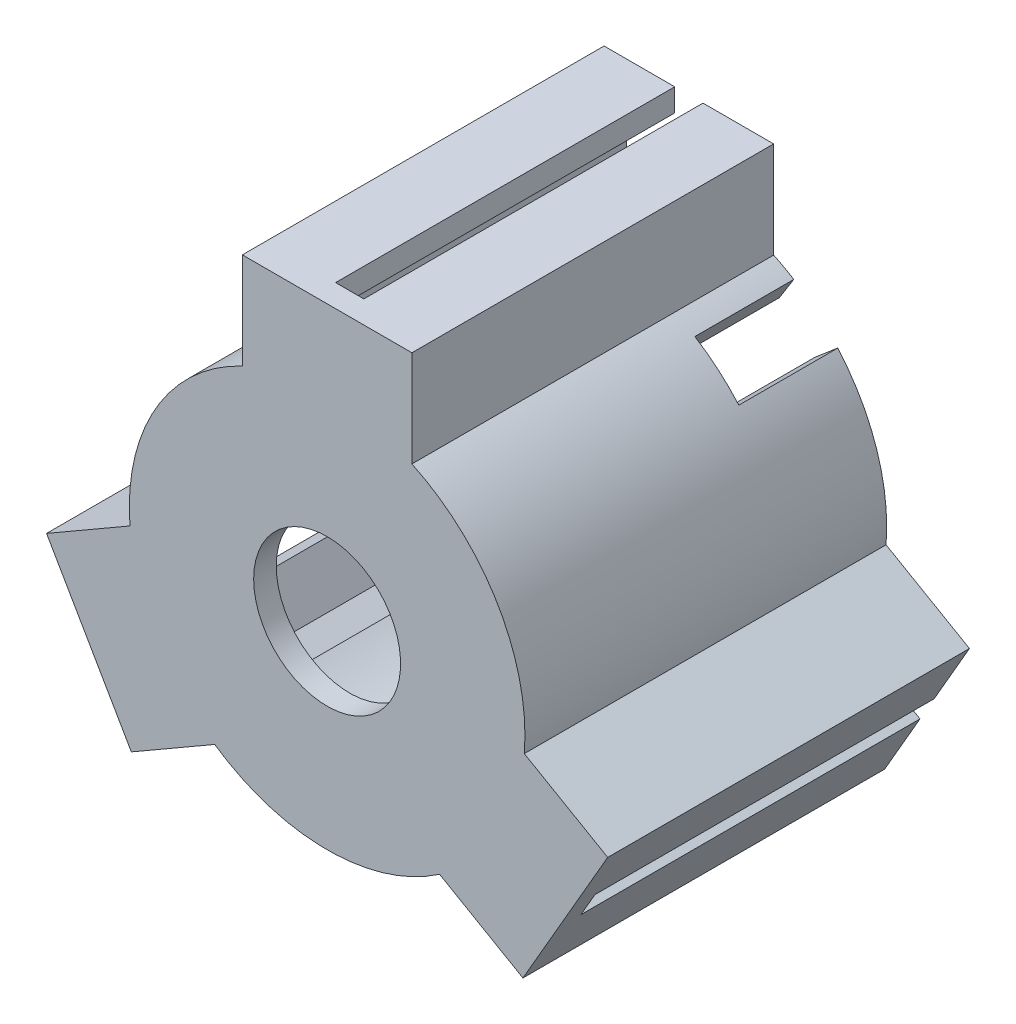
from build123d import *

# Parameters (mm, degrees)
SALIENTE_EXTRUIR1_DEPTH = 0.8
SALIENTE_EXTRUIR2_START = 12
SALIENTE_EXTRUIR2_DEPTH = 12
CROQUIS3_R              = 2.6
CORTAR_EXTRUIR1_DEPTH   = 0.8
CORTAR_EXTRUIR2_DEPTH   = 3.5


with BuildPart() as part:
    # Croquis1 → Saliente-Extruir1 (new body)
    with BuildSketch(Plane.XY):
        with BuildLine():
            Line((-64.04061015, 19.417127137), (-64.04061015, 22.824622624))
            Line((-64.04061015, 22.824622624), (-58.04061015, 22.824622624))
            Line((-58.04061015, 22.824622624), (-58.04061015, 19.417127137))
            ThreePointArc((-58.04061015, 19.417127137), (-54.978432324, 16.592571816), (-54.063384575, 12.528370368))
            Line((-54.063384575, 12.528370368), (-51.11240692, 10.824622624))
            Line((-51.11240692, 10.824622624), (-54.11240692, 5.628470201))
            Line((-54.11240692, 5.628470201), (-57.063384575, 7.332217945))
            ThreePointArc((-57.063384575, 7.332217945), (-61.04061015, 6.092571816), (-65.017835725, 7.332217945))
            Line((-65.017835725, 7.332217945), (-67.96881338, 5.628470201))
            Line((-67.96881338, 5.628470201), (-70.96881338, 10.824622624))
            Line((-70.96881338, 10.824622624), (-68.017835725, 12.528370368))
            ThreePointArc((-68.017835725, 12.528370368), (-67.102787977, 16.592571816), (-64.04061015, 19.417127137))
        make_face()
    extrude(amount=SALIENTE_EXTRUIR1_DEPTH)

    # Croquis2 → Saliente-Extruir2 (add)
    with BuildSketch(Plane(origin=(0, 0, 0), x_dir=(-1, 0, 0), z_dir=(0, 0, -1)).offset(SALIENTE_EXTRUIR2_START)):
        with BuildLine():
            Line((69.71881338, 8.659559114), (70.96881338, 10.824622624))
            Line((70.96881338, 10.824622624), (68.017835725, 12.528370368))
            ThreePointArc((68.017835725, 12.528370368), (67.102787977, 16.592571816), (64.04061015, 19.417127137))
            Line((64.04061015, 19.417127137), (64.04061015, 22.824622624))
            Line((64.04061015, 22.824622624), (61.54061015, 22.824622624))
            Line((61.54061015, 22.824622624), (61.54061015, 22.022889547))
            Line((61.54061015, 22.022889547), (63.24061015, 22.022889547))
            Line((63.24061015, 22.022889547), (63.24061015, 18.822889547))
            ThreePointArc((63.24061015, 18.822889547), (66.17949039, 16.05878973), (67.104711765, 12.131802301))
            Line((67.104711765, 12.131802301), (69.875993057, 10.531802301))
            Line((69.875993057, 10.531802301), (69.025993057, 9.059559114))
            Line((69.025993057, 9.059559114), (69.71881338, 8.659559114))
        make_face()
        with BuildLine():
            Line((65.017835725, 7.332217945), (67.96881338, 5.628470201))
            Line((67.96881338, 5.628470201), (69.21881338, 7.793533711))
            Line((69.21881338, 7.793533711), (68.524492169, 8.194400249))
            Line((68.524492169, 8.194400249), (67.674492169, 6.722157062))
            Line((67.674492169, 6.722157062), (64.903210877, 8.322157062))
            ThreePointArc((64.903210877, 8.322157062), (61.039990097, 7.159062025), (57.176508535, 8.321290524))
            Line((57.176508535, 8.321290524), (54.405227243, 6.721290524))
            Line((54.405227243, 6.721290524), (53.555227243, 8.193533711))
            Line((53.555227243, 8.193533711), (52.86240692, 7.793533711))
            Line((52.86240692, 7.793533711), (54.11240692, 5.628470201))
            Line((54.11240692, 5.628470201), (57.063384575, 7.332217945))
            ThreePointArc((57.063384575, 7.332217945), (61.04061015, 6.092571816), (65.017835725, 7.332217945))
        make_face()
        with BuildLine():
            Line((54.063384575, 12.528370368), (51.11240692, 10.824622624))
            Line((51.11240692, 10.824622624), (52.36240692, 8.659559114))
            Line((52.36240692, 8.659559114), (53.056728131, 9.060425653))
            Line((53.056728131, 9.060425653), (52.206728131, 10.532668839))
            Line((52.206728131, 10.532668839), (54.978009423, 12.132668839))
            ThreePointArc((54.978009423, 12.132668839), (55.902349964, 16.059863694), (58.84061015, 18.824622624))
            Line((58.84061015, 18.824622624), (58.84061015, 22.024622624))
            Line((58.84061015, 22.024622624), (60.54061015, 22.024622624))
            Line((60.54061015, 22.024622624), (60.54061015, 22.824622624))
            Line((60.54061015, 22.824622624), (58.04061015, 22.824622624))
            Line((58.04061015, 22.824622624), (58.04061015, 19.417127137))
            ThreePointArc((58.04061015, 19.417127137), (54.978432324, 16.592571816), (54.063384575, 12.528370368))
        make_face()
    extrude(amount=-SALIENTE_EXTRUIR2_DEPTH)

    # Croquis3 → Cortar-Extruir1 (cut)
    with BuildSketch(Plane(origin=(0, 0, 0), x_dir=(-1, 0, 0), z_dir=(0, 0, -1))):
        with Locations((61.04061015, 13.092571816)):
            Circle(CROQUIS3_R)
    extrude(amount=-CORTAR_EXTRUIR1_DEPTH, mode=Mode.SUBTRACT)

    # Croquis4 → Cortar-Extruir2 (cut)
    with BuildSketch(Plane(origin=(0, 0, -12), x_dir=(-1, 0, 0), z_dir=(0, 0, -1))):
        with BuildLine():
            Line((57.837187447, 18.214022309), (57.328521133, 19.027249156))
            ThreePointArc((57.328521133, 19.027249156), (56.502144155, 18.421955122), (55.772953312, 17.70253835))
            Line((55.772953312, 17.70253835), (56.572877184, 17.024384005))
            ThreePointArc((56.572877184, 17.024384005), (57.168010519, 17.658548761), (57.837187447, 18.214022309))
        make_face()
        with BuildLine():
            Line((67.077627732, 13.30609201), (68.036235998, 13.339996536))
            ThreePointArc((68.036235998, 13.339996536), (67.925224476, 14.358307009), (67.666786697, 15.34951319))
            Line((67.666786697, 15.34951319), (66.679525872, 14.995835968))
            ThreePointArc((66.679525872, 14.995835968), (66.931161993, 14.163353003), (67.077627732, 13.30609201))
        make_face()
        with BuildLine():
            Line((58.207015271, 7.757601131), (57.757073319, 6.910469757))
            ThreePointArc((57.757073319, 6.910469757), (58.694461819, 6.497453318), (59.682090441, 6.22566391))
            Line((59.682090441, 6.22566391), (59.869427395, 7.257495476))
            ThreePointArc((59.869427395, 7.257495476), (59.022657939, 7.455813685), (58.207015271, 7.757601131))
        make_face()
    extrude(amount=-CORTAR_EXTRUIR2_DEPTH, mode=Mode.SUBTRACT)


solid = part.part
